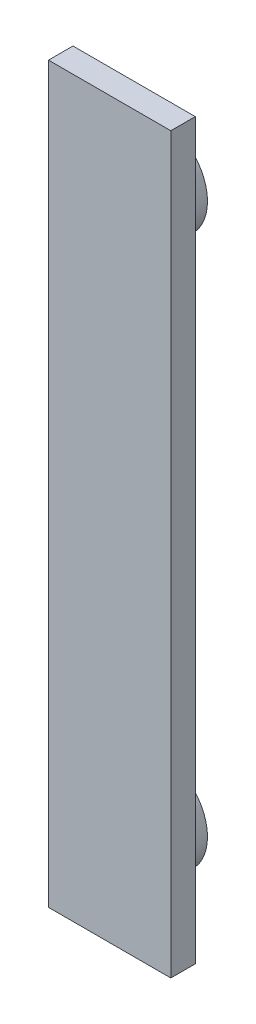
from build123d import *

# Parameters (mm, degrees)
SKETCH1_W           = 10
SKETCH1_H           = 60
BOSS_EXTRUDE1_DEPTH = 2
SKETCH1_3_R         = 4
BOSS_EXTRUDE2_DEPTH = 2


with BuildPart() as part:
    # Sketch1 → Boss-Extrude1 (new body)
    with BuildSketch(Plane.XY):
        Rectangle(SKETCH1_W, SKETCH1_H)
    extrude(amount=BOSS_EXTRUDE1_DEPTH)

    # Sketch1<3> → Boss-Extrude2 (add)
    with BuildSketch(Plane.XY):
        with Locations((0, 22.5)):
            Circle(SKETCH1_3_R)
        with Locations((0, -22.5)):
            Circle(SKETCH1_3_R)
    extrude(amount=-BOSS_EXTRUDE2_DEPTH)


solid = part.part
